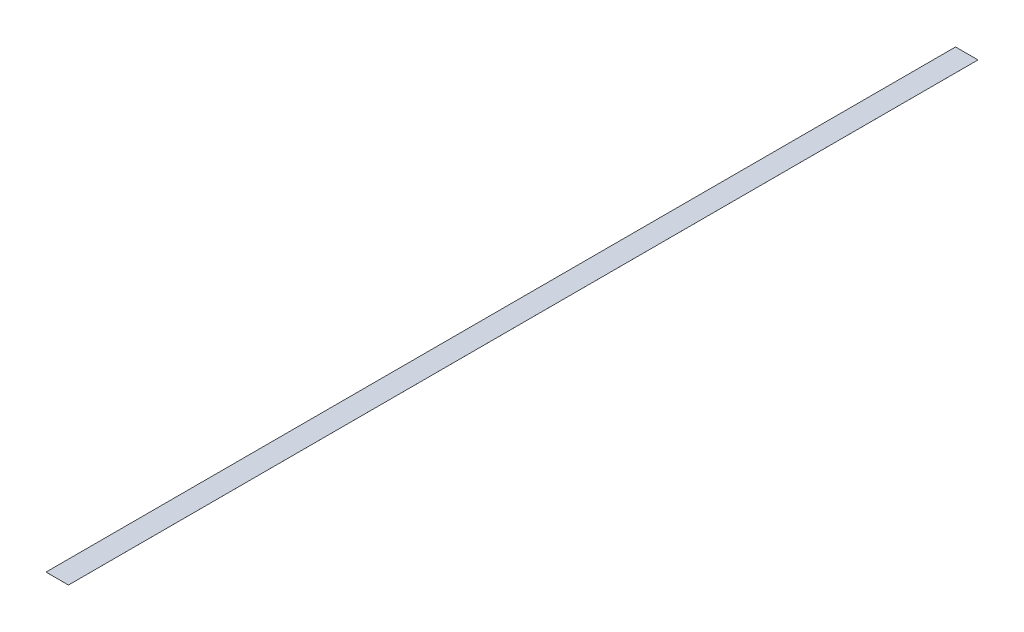
from build123d import *

# Parameters (mm, degrees)
ESBO_O1_W                = 18.934391242
ESBO_O1_H                = 766.866190092
RESSALTO_EXTRUS_O5_DEPTH = 0.01


with BuildPart() as part:
    # Esboço1 → Ressalto-extrusão5 (new body)
    with BuildSketch(Plane(origin=(0, 0, 0), x_dir=(1, 0, 0), z_dir=(0, 1, 0))):
        with Locations((535.733625229, 652.437591228)):
            Rectangle(ESBO_O1_W, ESBO_O1_H)
    extrude(amount=RESSALTO_EXTRUS_O5_DEPTH)


solid = part.part
